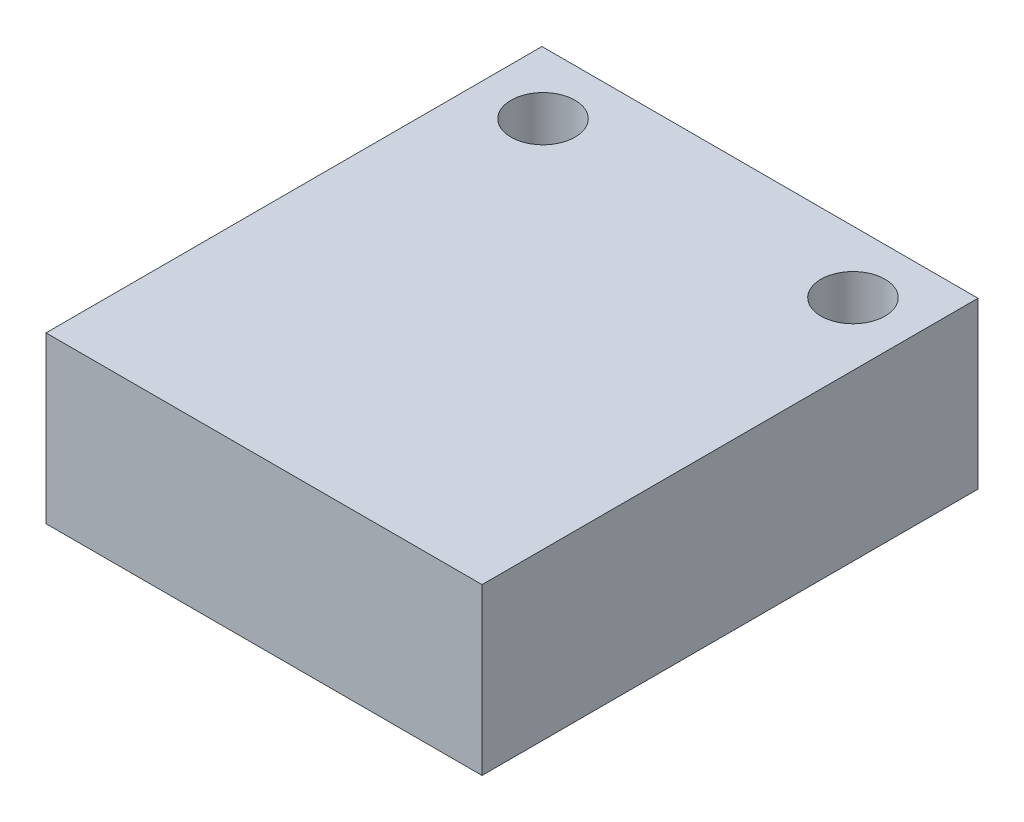
from build123d import *

# Parameters (mm, degrees)
SKETCH_1_W          = 21.1
SKETCH_1_H          = 24
EXTRUDE_1_DEPTH     = 8
SKETCH_2_R          = 1.55
CUT_EXTRUDE_1_DEPTH = 8


with BuildPart() as part:
    # 草图1 → 凸台-拉伸1 (new body)
    with BuildSketch(Plane(origin=(0, 0, 0), x_dir=(1, 0, 0), z_dir=(0, 1, 0))):
        Rectangle(SKETCH_1_W, SKETCH_1_H)
    extrude(amount=EXTRUDE_1_DEPTH)

    # 草图2 → 切除-拉伸1 (cut)
    with BuildSketch(Plane(origin=(0, 8, 0), x_dir=(1, 0, 0), z_dir=(0, 1, 0))):
        with Locations(Location((-7.5, 9, 0), (0, 0, 270))):
            Circle(SKETCH_2_R)
        with Locations(Location((7.5, 9, 0), (0, 0, 90))):
            Circle(SKETCH_2_R)
    extrude(amount=-CUT_EXTRUDE_1_DEPTH, mode=Mode.SUBTRACT)


solid = part.part
